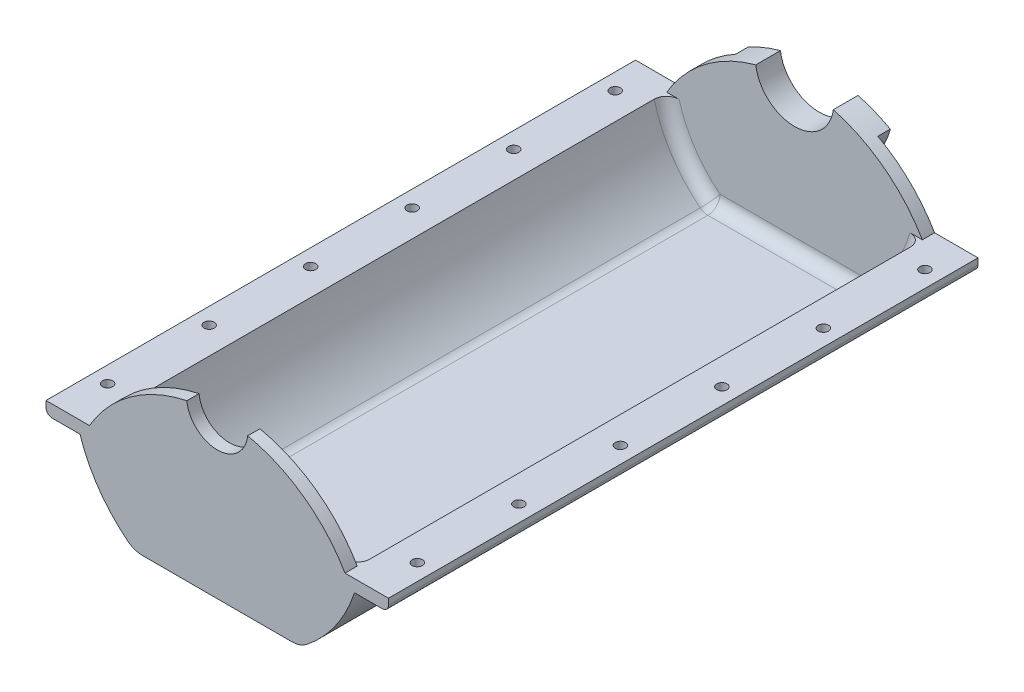
from build123d import *

# Parameters (mm, degrees)
SALIENTE_EXTRUIR1_DEPTH              = 482
VACIADO1_T                           = -10
REDONDEO1_R                          = 10
REDONDEO2_R                          = 10
SALIENTE_EXTRUIR2_START              = -482
SALIENTE_EXTRUIR2_DEPTH              = 482
REDONDEO3_R                          = 5
SALIENTE_EXTRUIR3_DEPTH              = 10
SALIENTE_EXTRUIR4_DEPTH              = 10.2
SALIENTE_EXTRUIR5_START              = -10
SALIENTE_EXTRUIR5_DEPTH              = 10
RANURA_DE_MARGEN_PARA_M81_AT_2_COUNT = 2
RANURA_DE_MARGEN_PARA_M81_AT_2_PITCH = 83
RANURA_DE_MARGEN_PARA_M81_AT_3_COUNT = 2
RANURA_DE_MARGEN_PARA_M81_AT_3_PITCH = 166
RANURA_DE_MARGEN_PARA_M81_AT_4_COUNT = 2
RANURA_DE_MARGEN_PARA_M81_AT_4_PITCH = 249
RANURA_DE_MARGEN_PARA_M81_AT_5_COUNT = 2
RANURA_DE_MARGEN_PARA_M81_AT_5_PITCH = 332
RANURA_DE_MARGEN_PARA_M81_AT_6_COUNT = 2
RANURA_DE_MARGEN_PARA_M81_AT_6_PITCH = 415


with BuildPart() as part:
    # Croquis1 → Saliente-Extruir1 (new body)
    with BuildSketch(Plane.XY):
        with BuildLine():
            Line((0, 0), (230, 0))
            ThreePointArc((230, 0), (214.777511796, -36.557011873), (188.317948474, -66.019373845))
            ThreePointArc((188.317948474, -66.019373845), (182.470809449, -69.235256105), (175.891177547, -70.348529442))
            Line((175.891177547, -70.348529442), (54.108822453, -70.348529442))
            ThreePointArc((54.108822453, -70.348529442), (47.529190551, -69.235256105), (41.682051526, -66.019373845))
            ThreePointArc((41.682051526, -66.019373845), (15.222488204, -36.557011873), (0, 0))
        make_face()
    extrude(amount=SALIENTE_EXTRUIR1_DEPTH)

    # Vaciado1
    vaciado1_openings = [part.faces().sort_by_distance(p)[0] for p in [
        (115, 0, 241),
    ]]
    offset(amount=VACIADO1_T, openings=vaciado1_openings, kind=Kind.INTERSECTION)

    # Redondeo1
    redondeo1_edges = [part.edges().sort_by_distance(p)[0] for p in [
        (24.298628648, -32.189552634, 472),
        (50.819006502, -59.791892774, 472),
        (115, -60.348529442, 472),
        (179.180993498, -59.791892774, 472),
        (205.701371352, -32.189552634, 472),
    ]]
    fillet(redondeo1_edges, radius=REDONDEO1_R)

    # Redondeo2
    redondeo2_edges = [part.edges().sort_by_distance(p)[0] for p in [
        (24.298628648, -32.189552634, 10),
        (50.819006502, -59.791892774, 10),
        (115, -60.348529442, 10),
        (179.180993498, -59.791892774, 10),
        (205.701371352, -32.189552634, 10),
    ]]
    fillet(redondeo2_edges, radius=REDONDEO2_R)

    # Croquis2 → Saliente-Extruir2 (add)
    with BuildSketch(Plane.XY.offset(482).offset(SALIENTE_EXTRUIR2_START)):
        with BuildLine():
            Line((2.767082202, -10), (-25.0029178, -10))
            Line((-25.0029178, -10), (-25.0029178, 0))
            Line((-25.0029178, 0), (0, 0))
            ThreePointArc((0, 0), (1.273575047, -5.030428511), (2.767082202, -10))
        make_face()
        with BuildLine():
            Line((255.0029178, 0), (230, 0))
            ThreePointArc((230, 0), (228.726424953, -5.030428511), (227.232917798, -10))
            Line((227.232917798, -10), (255.0029178, -10))
            Line((255.0029178, -10), (255.0029178, 0))
        make_face()
    extrude(amount=SALIENTE_EXTRUIR2_DEPTH)

    # Redondeo3
    redondeo3_edges = [part.edges().sort_by_distance(p)[0] for p in [
        (-25.0029178, -10, 241),
        (255.0029178, -10, 241),
    ]]
    fillet(redondeo3_edges, radius=REDONDEO3_R)



with BuildPart() as body_2:
    # Croquis3 → Saliente-Extruir3 (new body)
    with BuildSketch(Plane(origin=(0, 0, 0), x_dir=(-1, 0, 0), z_dir=(0, 0, -1))):
        with BuildLine():
            Line((-10.515, 0), (-219.485, 0))
            ThreePointArc((-219.485, 0), (-188.589303813, 35.043815425), (-146.718891775, 55.767754196))
            ThreePointArc((-146.718891775, 55.767754196), (-115, 28), (-83.281108225, 55.767754196))
            ThreePointArc((-83.281108225, 55.767754196), (-41.410696187, 35.043815425), (-10.515, 0))
        make_face()
    extrude(amount=-SALIENTE_EXTRUIR3_DEPTH)


with BuildPart() as part_1:
    add(part.part)

    add(body_2.part)  # Saliente-Extruir4 merges body 2
    # Croquis4 → Saliente-Extruir4 (add)
    with BuildSketch(Plane(origin=(0, 0, 0), x_dir=(-1, 0, 0), z_dir=(0, 0, -1))):
        with BuildLine():
            ThreePointArc((-173.125860697, 45.121010845), (-115, 0), (-56.874139303, 45.121010845))
            ThreePointArc((-56.874139303, 45.121010845), (-69.763309442, 51.223971947), (-83.281108225, 55.767754196))
            ThreePointArc((-83.281108225, 55.767754196), (-115, 28), (-146.718891775, 55.767754196))
            ThreePointArc((-146.718891775, 55.767754196), (-160.236690558, 51.223971947), (-173.125860697, 45.121010845))
        make_face()
    extrude(amount=SALIENTE_EXTRUIR4_DEPTH)

    # Croquis5 → Saliente-Extruir5 (add)
    with BuildSketch(Plane.XY.offset(482).offset(SALIENTE_EXTRUIR5_START)):
        with BuildLine():
            ThreePointArc((83.281108225, 55.767754196), (41.410696187, 35.043815425), (10.515, 0))
            Line((10.515, 0), (219.485, 0))
            ThreePointArc((219.485, 0), (188.589303813, 35.043815425), (146.718891775, 55.767754196))
            ThreePointArc((146.718891775, 55.767754196), (115, 28), (83.281108225, 55.767754196))
        make_face()
        with BuildLine():
            ThreePointArc((90.133812203, 57.416842161), (86.69544771, 56.642215547), (83.281108225, 55.767754196))
            ThreePointArc((83.281108225, 55.767754196), (115, 28), (146.718891775, 55.767754196))
            ThreePointArc((146.718891775, 55.767754196), (143.30455229, 56.642215547), (139.866187797, 57.416842161))
            ThreePointArc((139.866187797, 57.416842161), (115, 35), (90.133812203, 57.416842161))
        make_face()
    extrude(amount=SALIENTE_EXTRUIR5_DEPTH)

    # Croquis8 → Ranura de margen para M81 (revolve, cut)
    with BuildSketch(Plane(origin=(-11.6229178, 0, 30), x_dir=(0, 0, 1), z_dir=(1, 0, 0))):
        Polygon((0, 0), (0, 92.5236146), (4.2, 90), (4.2, 0), align=None)
    ranura_de_margen_para_m81 = revolve(axis=Axis((-11.6229178, 6.35, 30), (0, -1, 0)), mode=Mode.SUBTRACT)

    # Ranura de margen para M81 at 2: Ranura de margen para M81 ×2
    with Locations(*[(0, 0, i * RANURA_DE_MARGEN_PARA_M81_AT_2_PITCH) for i in range(1, RANURA_DE_MARGEN_PARA_M81_AT_2_COUNT)]):
        add(ranura_de_margen_para_m81, mode=Mode.SUBTRACT)

    # Ranura de margen para M81 at 3: Ranura de margen para M81 ×2
    with Locations(*[(0, 0, i * RANURA_DE_MARGEN_PARA_M81_AT_3_PITCH) for i in range(1, RANURA_DE_MARGEN_PARA_M81_AT_3_COUNT)]):
        add(ranura_de_margen_para_m81, mode=Mode.SUBTRACT)

    # Ranura de margen para M81 at 4: Ranura de margen para M81 ×2
    with Locations(*[(0, 0, i * RANURA_DE_MARGEN_PARA_M81_AT_4_PITCH) for i in range(1, RANURA_DE_MARGEN_PARA_M81_AT_4_COUNT)]):
        add(ranura_de_margen_para_m81, mode=Mode.SUBTRACT)

    # Ranura de margen para M81 at 5: Ranura de margen para M81 ×2
    with Locations(*[(0, 0, i * RANURA_DE_MARGEN_PARA_M81_AT_5_PITCH) for i in range(1, RANURA_DE_MARGEN_PARA_M81_AT_5_COUNT)]):
        add(ranura_de_margen_para_m81, mode=Mode.SUBTRACT)

    # Ranura de margen para M81 at 6: Ranura de margen para M81 ×2
    with Locations(*[(0, 0, i * RANURA_DE_MARGEN_PARA_M81_AT_6_PITCH) for i in range(1, RANURA_DE_MARGEN_PARA_M81_AT_6_COUNT)]):
        add(ranura_de_margen_para_m81, mode=Mode.SUBTRACT)

    # Simetría1: Ranura de margen para M81 across plane
    add(ranura_de_margen_para_m81.mirror(Plane(origin=(115, 0, 0), x_dir=(0, 0, 1), z_dir=(1, 0, 0))), mode=Mode.SUBTRACT)

    # Simetría1 copy 1 sketch → Simetría1 copy 1 (revolve, cut)
    with BuildSketch(Plane(origin=(241.6229178, 0, 113), x_dir=(0, 0, 1), z_dir=(-1, 0, 0))):
        Polygon((0, 0), (0, -92.5236146), (4.2, -90), (4.2, 0), align=None)
    revolve(axis=Axis((241.6229178, 6.35, 113), (0, 1, 0)), mode=Mode.SUBTRACT)

    # Simetría1 copy 2 sketch → Simetría1 copy 2 (revolve, cut)
    with BuildSketch(Plane(origin=(241.6229178, 0, 196), x_dir=(0, 0, 1), z_dir=(-1, 0, 0))):
        Polygon((0, 0), (0, -92.5236146), (4.2, -90), (4.2, 0), align=None)
    revolve(axis=Axis((241.6229178, 6.35, 196), (0, 1, 0)), mode=Mode.SUBTRACT)

    # Simetría1 copy 3 sketch → Simetría1 copy 3 (revolve, cut)
    with BuildSketch(Plane(origin=(241.6229178, 0, 279), x_dir=(0, 0, 1), z_dir=(-1, 0, 0))):
        Polygon((0, 0), (0, -92.5236146), (4.2, -90), (4.2, 0), align=None)
    revolve(axis=Axis((241.6229178, 6.35, 279), (0, 1, 0)), mode=Mode.SUBTRACT)

    # Simetría1 copy 4 sketch → Simetría1 copy 4 (revolve, cut)
    with BuildSketch(Plane(origin=(241.6229178, 0, 362), x_dir=(0, 0, 1), z_dir=(-1, 0, 0))):
        Polygon((0, 0), (0, -92.5236146), (4.2, -90), (4.2, 0), align=None)
    revolve(axis=Axis((241.6229178, 6.35, 362), (0, 1, 0)), mode=Mode.SUBTRACT)

    # Simetría1 copy 5 sketch → Simetría1 copy 5 (revolve, cut)
    with BuildSketch(Plane(origin=(241.6229178, 0, 445), x_dir=(0, 0, 1), z_dir=(-1, 0, 0))):
        Polygon((0, 0), (0, -92.5236146), (4.2, -90), (4.2, 0), align=None)
    revolve(axis=Axis((241.6229178, 6.35, 445), (0, 1, 0)), mode=Mode.SUBTRACT)


solid = part_1.part
